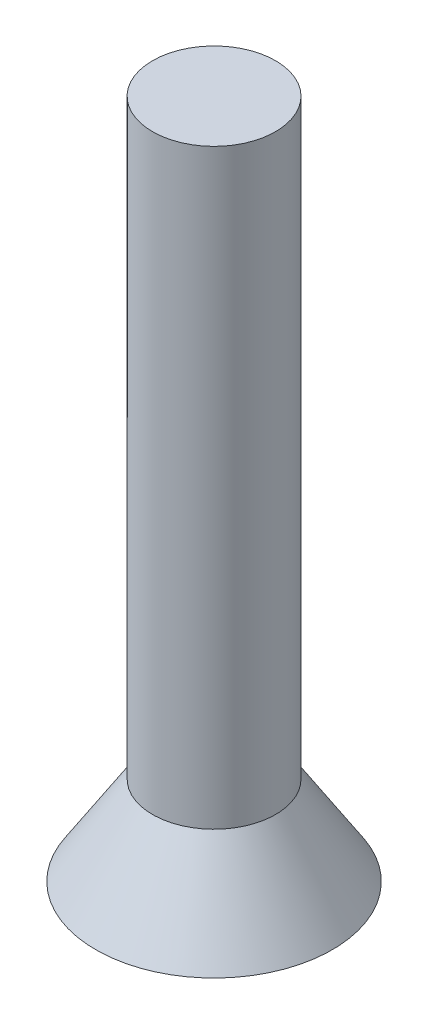
from build123d import *


with BuildPart() as part:
    # Sketch1 → Revolve3 (revolve)
    with BuildSketch(Plane.XY, mode=Mode.PRIVATE) as revolve3_sk:
        Polygon((0, 18.25625), (0, 0), (3.175, 0), (1.651, 2.38125), (1.651, 18.25625), align=None)
    revolve(revolve3_sk.sketch.rotate(Axis((0, 0, 0), (0, -1, 0)), 180), axis=Axis((0, 0, 0), (0, -1, 0)))


solid = part.part
